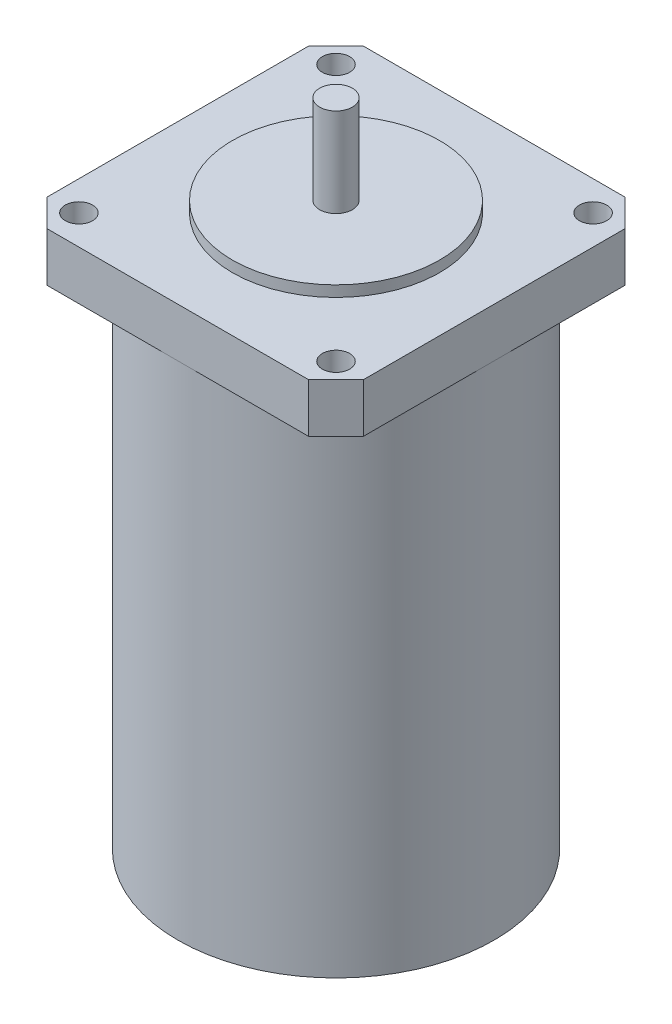
from build123d import *

# Parameters (mm, degrees)
SKETCH2_R           = 29
BOSS_EXTRUDE1_DEPTH = 101
SKETCH3_R           = 2.5
BOSS_EXTRUDE2_DEPTH = 9
SKETCH4_R           = 19
BOSS_EXTRUDE3_DEPTH = 2
SKETCH5_R           = 3
BOSS_EXTRUDE4_DEPTH = 16.3


with BuildPart() as part:
    # Sketch2 → Boss-Extrude1 (new body)
    with BuildSketch(Plane(origin=(0, 0, 0), x_dir=(1, 0, 0), z_dir=(0, 1, 0))):
        with Locations(Location((0, 0, 0), (0, 0, 270))):
            Circle(SKETCH2_R)
    extrude(amount=BOSS_EXTRUDE1_DEPTH)

    # Sketch3 → Boss-Extrude2 (add)
    with BuildSketch(Plane(origin=(0, 101, 0), x_dir=(1, 0, 0), z_dir=(0, 1, 0))):
        Polygon((-29, 24), (-24, 29), (24, 29), (29, 24), (29, -24), (24, -29), (-24, -29), (-29, -24), align=None)
        with Locations(Location((-23.57, 23.57, 0), (0, 0, 270))):
            Circle(SKETCH3_R, mode=Mode.SUBTRACT)
        with Locations(Location((23.57, 23.57, 0), (0, 0, 270))):
            Circle(SKETCH3_R, mode=Mode.SUBTRACT)
        with Locations(Location((23.57, -23.57, 0), (0, 0, 270))):
            Circle(SKETCH3_R, mode=Mode.SUBTRACT)
        with Locations(Location((-23.57, -23.57, 0), (0, 0, 270))):
            Circle(SKETCH3_R, mode=Mode.SUBTRACT)
    extrude(amount=-BOSS_EXTRUDE2_DEPTH)

    # Sketch4 → Boss-Extrude3 (add)
    with BuildSketch(Plane(origin=(0, 101, 0), x_dir=(1, 0, 0), z_dir=(0, 1, 0))):
        with Locations(Location((0, 0, 0), (0, 0, 270))):
            Circle(SKETCH4_R)
    extrude(amount=BOSS_EXTRUDE3_DEPTH)

    # Sketch5 → Boss-Extrude4 (add)
    with BuildSketch(Plane(origin=(0, 103, 0), x_dir=(1, 0, 0), z_dir=(0, 1, 0))):
        with Locations(Location((0, 0, 0), (0, 0, 270))):
            Circle(SKETCH5_R)
    extrude(amount=BOSS_EXTRUDE4_DEPTH)


solid = part.part
